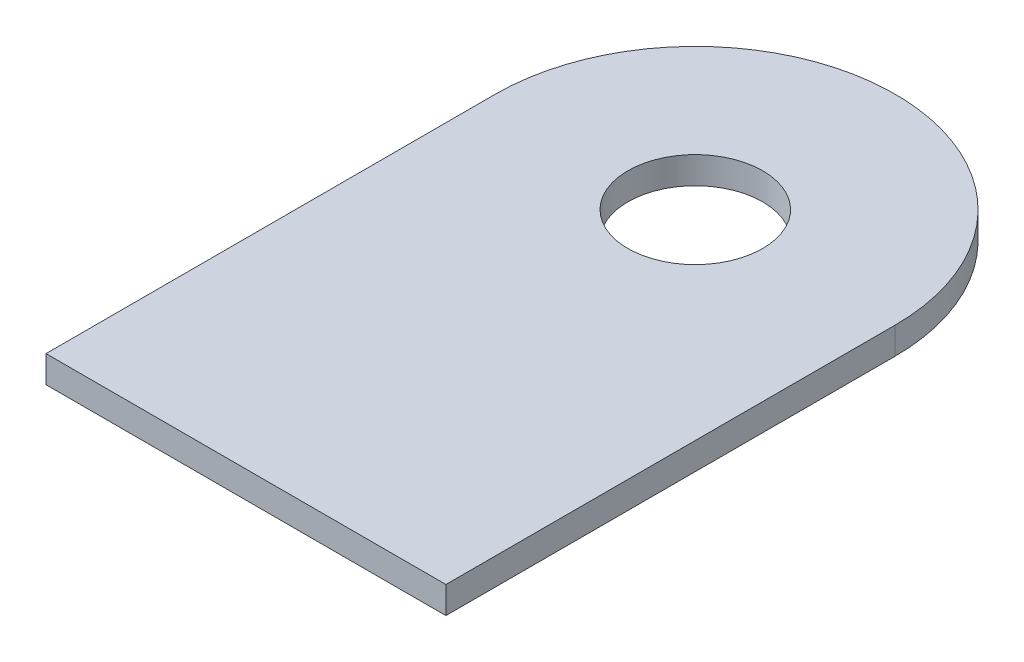
from build123d import *

# Parameters (mm, degrees)
SKETCH1_R           = 3.81
BOSS_EXTRUDE1_DEPTH = 1.524


with BuildPart() as part:
    # Sketch1 → Boss-Extrude1 (new body)
    with BuildSketch(Plane(origin=(0, 0, 0), x_dir=(1, 0, 0), z_dir=(0, 1, 0))):
        with BuildLine():
            Line((-11.303, -25.4), (11.303, -25.4))
            Line((11.303, -25.4), (11.303, 0))
            ThreePointArc((11.303, 0), (0, 11.303), (-11.303, 0))
            Line((-11.303, 0), (-11.303, -25.4))
        make_face()
        with Locations(Location((0, 0, 0), (0, 0, 90))):
            Circle(SKETCH1_R, mode=Mode.SUBTRACT)
    extrude(amount=BOSS_EXTRUDE1_DEPTH)


solid = part.part
